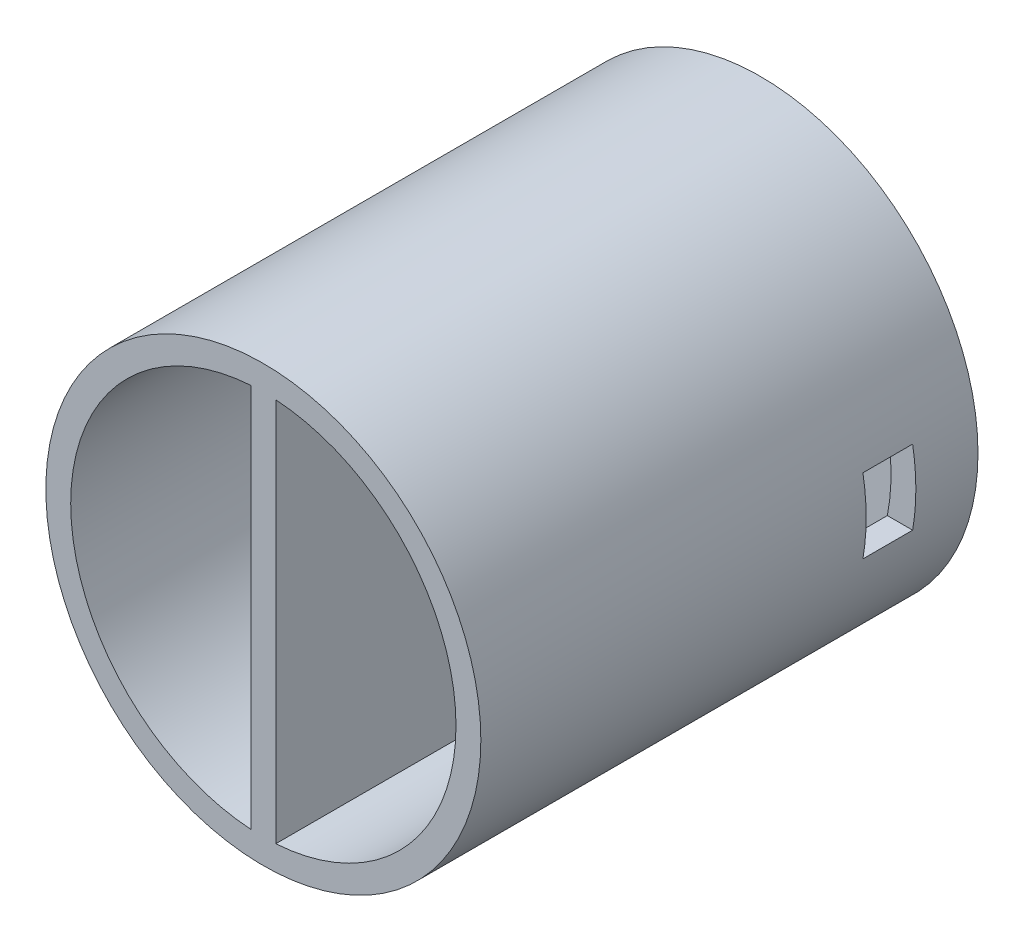
from build123d import *

# Parameters (mm, degrees)
SKETCH1_R           = 17.5
BOSS_EXTRUDE1_DEPTH = 2
SKETCH2_R           = 17.5
BOSS_EXTRUDE2_DEPTH = 38
SKETCH3_W           = 4
SKETCH3_H           = 6
CUT_EXTRUDE1_DEPTH  = 46.348649373
SKETCH4_W           = 4
SKETCH4_H           = 6
CUT_EXTRUDE2_DEPTH  = 48.418350878


with BuildPart() as part:
    # Sketch1 → Boss-Extrude1 (new body)
    with BuildSketch(Plane.XY):
        Circle(SKETCH1_R)
    extrude(amount=BOSS_EXTRUDE1_DEPTH)

    # Sketch2 → Boss-Extrude2 (add)
    with BuildSketch(Plane.XY.offset(2)):
        Circle(SKETCH2_R)
        with BuildLine():
            Line((-1, 15.467708298), (-1, -15.467708298))
            ThreePointArc((-1, -15.467708298), (-15.5, 0), (-1, 15.467708298))
        make_face(mode=Mode.SUBTRACT)
        with BuildLine():
            Line((1, 15.467708298), (1, -15.467708298))
            ThreePointArc((1, -15.467708298), (15.5, 0), (1, 15.467708298))
        make_face(mode=Mode.SUBTRACT)
    extrude(amount=BOSS_EXTRUDE2_DEPTH)

    # Sketch3 → Cut-Extrude1 (cut, through all)
    with BuildSketch(Plane.XY.offset(2)):
        with Locations((7, 0)):
            Rectangle(SKETCH3_W, SKETCH3_H)
        with Locations((-7, 0)):
            Rectangle(SKETCH3_W, SKETCH3_H)
    extrude(amount=-CUT_EXTRUDE1_DEPTH, mode=Mode.SUBTRACT)

    # Sketch4 → Cut-Extrude2 (cut, through all)
    with BuildSketch(Plane.ZY.offset(1)):
        with Locations((7, 0)):
            Rectangle(SKETCH4_W, SKETCH4_H)
    cut_extrude2 = extrude(amount=CUT_EXTRUDE2_DEPTH, mode=Mode.SUBTRACT)

    # Mirror1: Cut-Extrude2 across plane
    add(cut_extrude2.mirror(Plane(origin=(0, 0, 0), x_dir=(0, 0, 1), z_dir=(1, 0, 0))), mode=Mode.SUBTRACT)


solid = part.part
